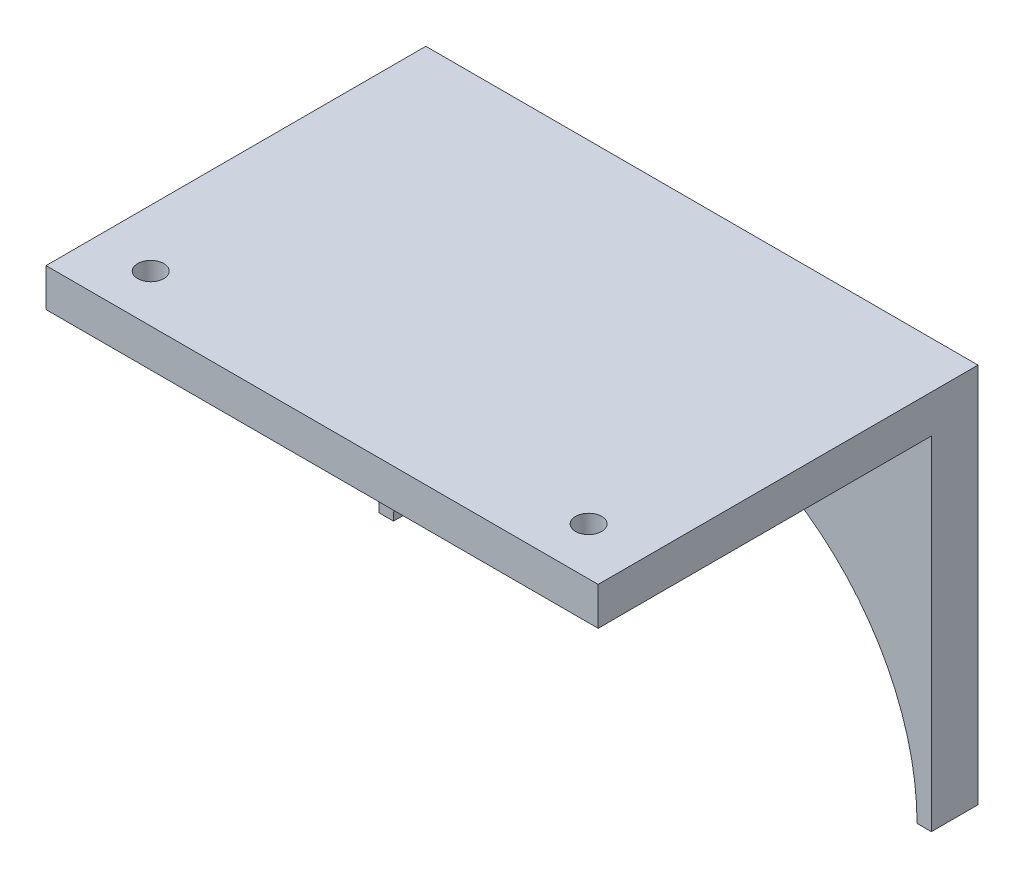
from build123d import *

# Parameters (mm, degrees)
BOSS_EXTRUDE1_DEPTH = 1.8
BOSS_EXTRUDE4_DEPTH = 8
SKETCH5_W           = 116
SKETCH5_H           = 70
BOSS_EXTRUDE5_DEPTH = 8
SKETCH6_R           = 2.75
CUT_EXTRUDE1_DEPTH  = 123.131240885


with BuildPart() as part:
    # Sketch1 → Boss-Extrude1 (new body)
    with BuildSketch(Plane.XY):
        with BuildLine():
            Line((50, 0), (58, 0))
            Line((58, 0), (58, 80))
            Line((58, 80), (-58, 80))
            Line((-58, 80), (-58, 0))
            Line((-58, 0), (-50, 0))
            ThreePointArc((-50, 0), (0, 50), (50, 0))
        make_face()
    extrude(amount=BOSS_EXTRUDE1_DEPTH)

    # Sketch4 → Boss-Extrude4 (add)
    with BuildSketch(Plane.XY.offset(1.8)):
        with BuildLine():
            Line((-58, 0), (-55, 0))
            ThreePointArc((-55, 0), (0, 55), (55, 0))
            Line((55, 0), (58, 0))
            Line((58, 0), (58, 80))
            Line((58, 80), (-58, 80))
            Line((-58, 80), (-58, 0))
        make_face()
    extrude(amount=BOSS_EXTRUDE4_DEPTH)

    # Sketch5 → Boss-Extrude5 (add)
    with BuildSketch(Plane(origin=(0, 80, 0), x_dir=(1, 0, 0), z_dir=(0, 1, 0))):
        with Locations((0, -44.8)):
            Rectangle(SKETCH5_W, SKETCH5_H)
    extrude(amount=-BOSS_EXTRUDE5_DEPTH)

    # Sketch6 → Cut-Extrude1 (cut, through all)
    with BuildSketch(Plane.XZ.offset(-72)):
        with Locations(Location((-46, 69.8, 0), (0, 0, 270))):
            Circle(SKETCH6_R)
        with Locations(Location((46, 69.8, 0), (0, 0, 270))):
            Circle(SKETCH6_R)
    extrude(amount=-CUT_EXTRUDE1_DEPTH, mode=Mode.SUBTRACT)


solid = part.part
